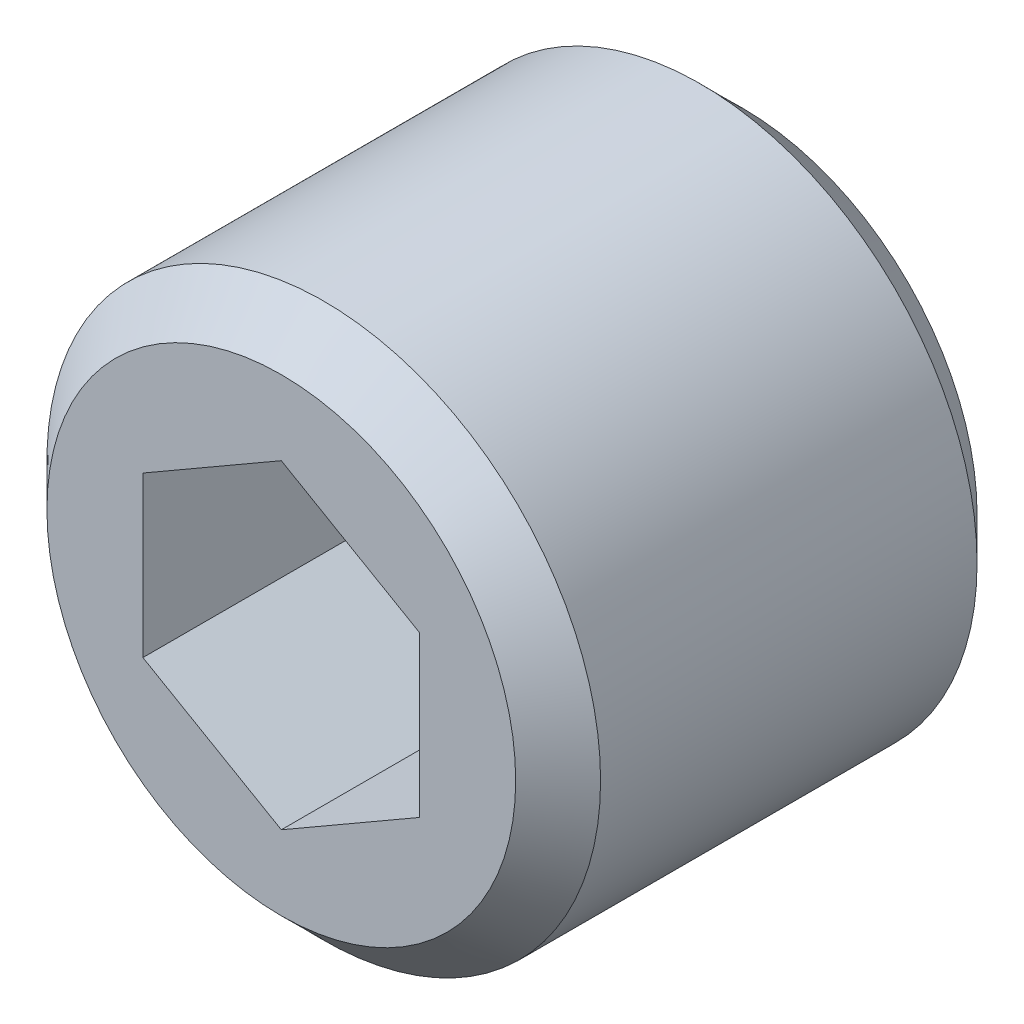
from build123d import *

# Parameters (mm, degrees)
SZKIC3_R                    = 4.164101615
DODANIE_WYCI_GNI_CIE1_DEPTH = 7.5


with BuildPart() as part:
    # Szkic1 → Obrót1 (revolve)
    with BuildSketch(Plane(origin=(0, 0, 0), x_dir=(0, 0, -1), z_dir=(1, 0, 0)), mode=Mode.PRIVATE) as obr_t1_sk:
        Polygon((-10, 0), (-10, 5.08), (-9.08, 6), (-0.92, 6), (0, 5.08), (0, 0), align=None)
    revolve(obr_t1_sk.sketch.rotate(Axis((0, 0, 0), (0, 0, 1)), 270), axis=Axis((0, 0, 0), (0, 0, 1)))

    # Szkic2 → Wycięcie-obrót1 (revolve, cut)
    with BuildSketch(Plane(origin=(0, 0, 0), x_dir=(0, 0, -1), z_dir=(1, 0, 0)), mode=Mode.PRIVATE) as wyci_cie_obr_t1_sk:
        Polygon((-10, 0), (-10, 3.964101615), (-5, 3.964101615), (-2.711324865, 0), align=None)
    revolve(wyci_cie_obr_t1_sk.sketch.rotate(Axis((0, 0, 2.711324865), (0, 0, 1)), 270), axis=Axis((0, 0, 2.711324865), (0, 0, 1)), mode=Mode.SUBTRACT)

    # Szkic3 → Dodanie-wyciągnięcie1 (add)
    with BuildSketch(Plane.XY.offset(10)):
        Circle(SZKIC3_R)
        Polygon((-3, 1.732050808), (-3, -1.732050808), (0, -3.464101615), (3, -1.732050808), (3, 1.732050808), (0, 3.464101615), align=None, mode=Mode.SUBTRACT)
    extrude(amount=-DODANIE_WYCI_GNI_CIE1_DEPTH)


solid = part.part
